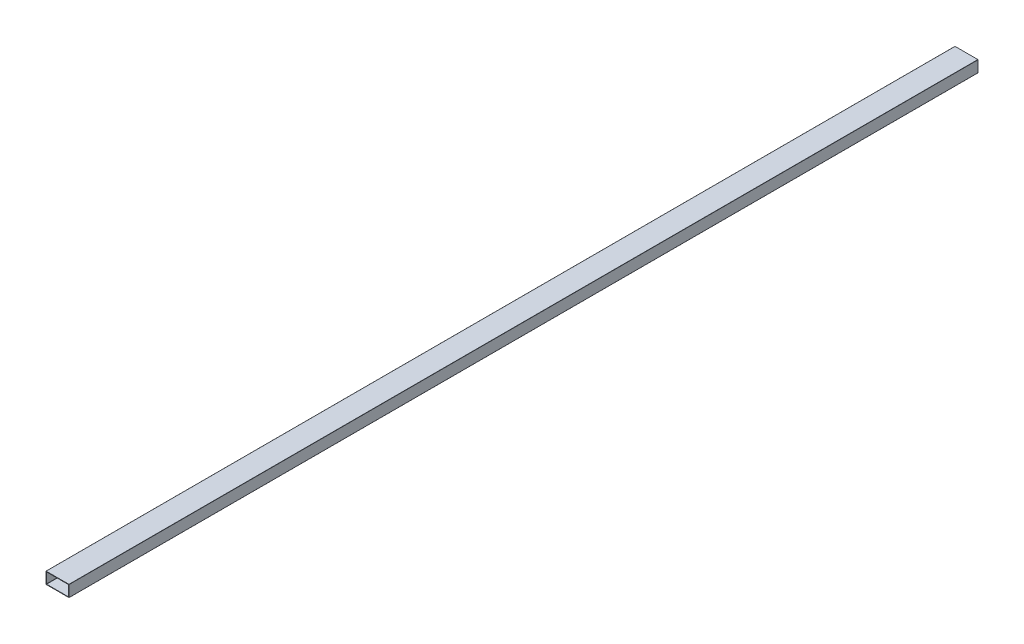
from build123d import *

# Parameters (mm, degrees)
CROQUIS1_W              = 152.4
CROQUIS1_H              = 76.2
CROQUIS1_W_2            = 146.32
CROQUIS1_H_2            = 70.12
SALIENTE_EXTRUIR1_DEPTH = 6000
REDONDEO1_R             = 1


with BuildPart() as part:
    # Croquis1 → Saliente-Extruir1 (new body)
    with BuildSketch(Plane.XY):
        Rectangle(CROQUIS1_W, CROQUIS1_H)
        Rectangle(CROQUIS1_W_2, CROQUIS1_H_2, mode=Mode.SUBTRACT)
    extrude(amount=-SALIENTE_EXTRUIR1_DEPTH)

    # Redondeo1
    redondeo1_edges = [part.edges().sort_by_distance(p)[0] for p in [
        (73.16, -35.06, -3000),
        (-73.16, -35.06, -3000),
        (-73.16, 35.06, -3000),
        (73.16, 35.06, -3000),
        (76.2, -38.1, -3000),
        (-76.2, -38.1, -3000),
        (-76.2, 38.1, -3000),
        (76.2, 38.1, -3000),
    ]]
    fillet(redondeo1_edges, radius=REDONDEO1_R)


solid = part.part
